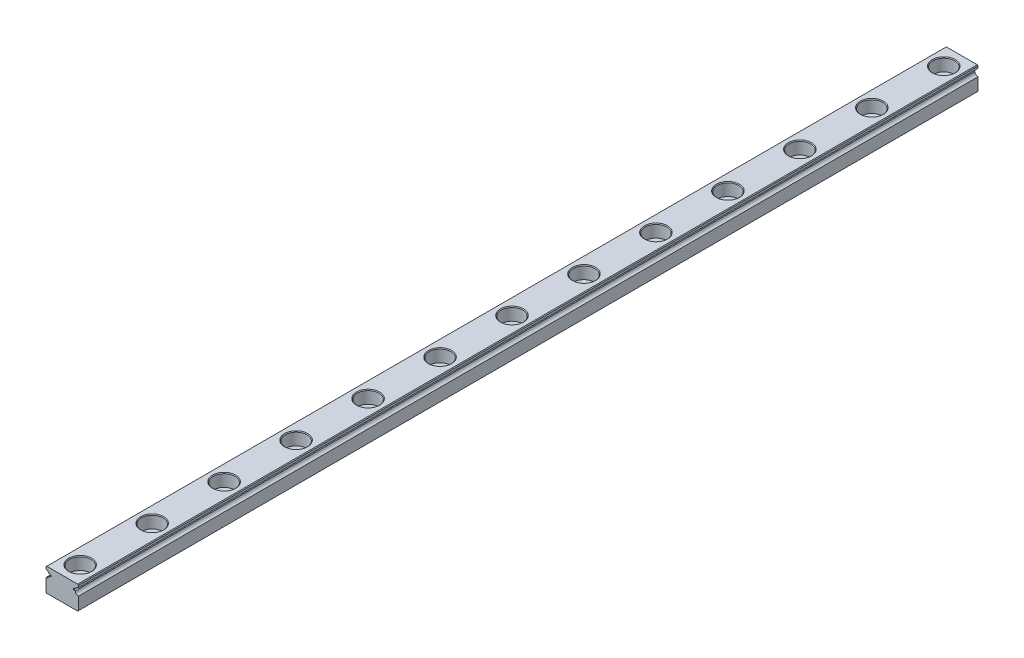
from build123d import *

# Parameters (mm, degrees)
EXTRUDE1_DEPTH             = 250
EXTRUDE2_REACH             = 252.125
SKETCH2_R                  = 1.75
SKETCH_R                   = 3
SKETCH_R_2                 = 1.75
EXTRUDE4_DEPTH             = 3.5
CHAMFER1_SIZE              = 0.2
LPATTERN1_COUNT            = 13
LPATTERN1_PITCH            = 20
CHAMFER1_OF_LPATTERN1_SIZE = 0.2


with BuildPart() as part:
    # Sketch1 → Extrude1 (new body)
    with BuildSketch(Plane.XY):
        with BuildLine():
            Line((-4.3, -3.25), (4.3, -3.25))
            Line((4.3, -3.25), (4.5, -3.05))
            Line((4.5, -3.05), (4.5, 0.455012563))
            ThreePointArc((4.5, 0.455012563), (3.924845827, 0.712323349), (3.617735397, 1.2625))
            Line((3.617735397, 1.2625), (3.15008224, 1.2625))
            Line((3.15008224, 1.2625), (3.15008224, 1.7625))
            Line((3.15008224, 1.7625), (3.65008224, 1.7625))
            ThreePointArc((3.65008224, 1.7625), (3.973877727, 2.229724887), (4.5, 2.444987437))
            Line((4.5, 2.444987437), (4.5, 3.05))
            Line((4.5, 3.05), (4.3, 3.25))
            Line((4.3, 3.25), (-4.3, 3.25))
            Line((-4.3, 3.25), (-4.5, 3.05))
            Line((-4.5, 3.05), (-4.5, 2.444987437))
            ThreePointArc((-4.5, 2.444987437), (-3.973877727, 2.229724887), (-3.65008224, 1.7625))
            Line((-3.65008224, 1.7625), (-3.15008224, 1.7625))
            Line((-3.15008224, 1.7625), (-3.15008224, 1.2625))
            Line((-3.15008224, 1.2625), (-3.617735397, 1.2625))
            ThreePointArc((-3.617735397, 1.2625), (-3.924845827, 0.712323349), (-4.5, 0.455012563))
            Line((-4.5, 0.455012563), (-4.5, -3.05))
            Line((-4.5, -3.05), (-4.3, -3.25))
        make_face()
    extrude(amount=EXTRUDE1_DEPTH)

    # Sketch2 → Extrude2 (cut, up to next)
    with BuildSketch(Plane(origin=(0, 3.25, 0), x_dir=(1, 0, 0), z_dir=(0, 1, 0)), mode=Mode.PRIVATE) as extrude2_sk1:
        with Locations((0, -5)):
            Circle(SKETCH2_R)
    extrude2_tool1 = extrude(extrude2_sk1.sketch, amount=-EXTRUDE2_REACH, mode=Mode.PRIVATE) & part.part
    extrude2 = extrude2_tool1.solids().sort_by_distance((0, 3.25, 5))[0]
    add(extrude2, mode=Mode.SUBTRACT)

    # Sketch → Extrude4 (cut)
    with BuildSketch(Plane(origin=(0, 3.25, 0), x_dir=(1, 0, 0), z_dir=(0, 1, 0))):
        with Locations((0, -5)):
            Circle(SKETCH_R)
        with Locations((0, -5)):
            Circle(SKETCH_R_2, mode=Mode.SUBTRACT)
    extrude4 = extrude(amount=-EXTRUDE4_DEPTH, mode=Mode.SUBTRACT)

    # Chamfer1
    chamfer1_edges = [part.edges().sort_by_distance(p)[0] for p in [
        (-1.75, -3.25, 5),
        (-3, 3.25, 5),
    ]]
    chamfer(chamfer1_edges, length=CHAMFER1_SIZE)

    # LPattern1: Extrude2, Extrude4 ×13
    with Locations(*[(0, 0, i * LPATTERN1_PITCH) for i in range(1, LPATTERN1_COUNT)]):
        add(extrude2, mode=Mode.SUBTRACT)
        add(extrude4, mode=Mode.SUBTRACT)

    # Chamfer1 of LPattern1
    chamfer1_of_lpattern1_edges = [part.edges().sort_by_distance(p)[0] for p in [
        (-1.75, -3.25, 25),
        (-3, 3.25, 25),
        (-1.75, -3.25, 45),
        (-3, 3.25, 45),
        (-1.75, -3.25, 65),
        (-3, 3.25, 65),
        (-1.75, -3.25, 85),
        (-3, 3.25, 85),
        (-1.75, -3.25, 105),
        (-3, 3.25, 105),
        (-1.75, -3.25, 125),
        (-3, 3.25, 125),
        (-1.75, -3.25, 145),
        (-3, 3.25, 145),
        (-1.75, -3.25, 165),
        (-3, 3.25, 165),
        (-1.75, -3.25, 185),
        (-3, 3.25, 185),
        (-1.75, -3.25, 205),
        (-3, 3.25, 205),
        (-1.75, -3.25, 225),
        (-3, 3.25, 225),
        (-1.75, -3.25, 245),
        (-3, 3.25, 245),
    ]]
    chamfer(chamfer1_of_lpattern1_edges, length=CHAMFER1_OF_LPATTERN1_SIZE)


solid = part.part
